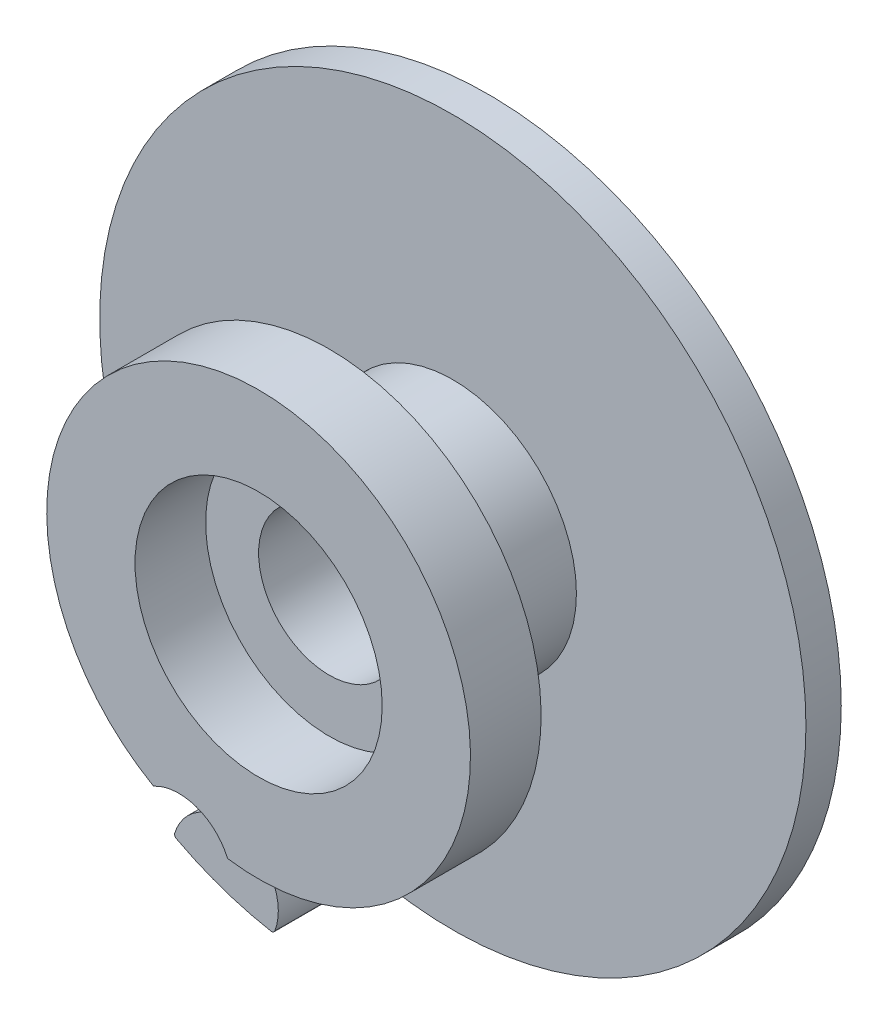
from build123d import *

# Parameters (mm, degrees)
SKETCH1_R           = 2
SKETCH1_R_2         = 0.4
BOSS_EXTRUDE1_DEPTH = 0.2
SKETCH1_9_R         = 0.7
SKETCH1_9_R_2       = 0.4
BOSS_EXTRUDE2_DEPTH = 0.9
BOSS_EXTRUDE3_START = 0.9
SKETCH1_10_R        = 0.7
BOSS_EXTRUDE3_DEPTH = 0.4
BOSS_EXTRUDE4_DEPTH = 0.9


with BuildPart() as part:
    # Sketch1 → Boss-Extrude1 (new body)
    with BuildSketch(Plane.XY):
        with Locations((0, 13.134272207)):
            Circle(SKETCH1_R)
        with Locations((0, 13.134272207)):
            Circle(SKETCH1_R_2, mode=Mode.SUBTRACT)
    extrude(amount=BOSS_EXTRUDE1_DEPTH)

    # Sketch1<9> → Boss-Extrude2 (add)
    with BuildSketch(Plane.XY):
        with Locations((0, 13.134272207)):
            Circle(SKETCH1_9_R)
        with Locations((0, 13.134272207)):
            Circle(SKETCH1_9_R_2, mode=Mode.SUBTRACT)
    extrude(amount=BOSS_EXTRUDE2_DEPTH)

    # Sketch1<11> → Boss-Extrude4 (add)
    with BuildSketch(Plane.XY):
        with BuildLine():
            ThreePointArc((-0.722952446, 11.701281818), (-0.80562228, 11.640057681), (-0.862748393, 11.554504753))
            ThreePointArc((-0.862748393, 11.554504753), (-0.769774263, 11.507174305), (-0.674214176, 11.465309882))
            Line((-0.674214176, 11.465309882), (-0.690125144, 11.647173071))
            ThreePointArc((-0.690125144, 11.647173071), (-0.707969637, 11.673359365), (-0.722952446, 11.701281818))
        make_face()
        with BuildLine():
            Line((-0.695904051, 11.713226287), (-0.690125144, 11.647173071))
            ThreePointArc((-0.690125144, 11.647173071), (-0.61018442, 11.574383117), (-0.509631962, 11.53465781))
            Line((-0.509631962, 11.53465781), (-0.526432402, 11.726687722))
            ThreePointArc((-0.526432402, 11.726687722), (-0.612141723, 11.732212758), (-0.695904051, 11.713226287))
        make_face()
        with BuildLine():
            Line((-0.690125144, 11.647173071), (-0.674214176, 11.465309882))
            ThreePointArc((-0.674214176, 11.465309882), (-0.587019252, 11.432682246), (-0.498253958, 11.404606635))
            Line((-0.498253958, 11.404606635), (-0.509631962, 11.53465781))
            ThreePointArc((-0.509631962, 11.53465781), (-0.61018442, 11.574383117), (-0.690125144, 11.647173071))
        make_face()
        with BuildLine():
            ThreePointArc((-0.498253958, 11.404606635), (-0.398618868, 11.378965112), (-0.297681545, 11.359057939))
            ThreePointArc((-0.297681545, 11.359057939), (-0.289740827, 11.461623242), (-0.316916575, 11.560841058))
            ThreePointArc((-0.316916575, 11.560841058), (-0.411093619, 11.531699297), (-0.509631962, 11.53465781))
            Line((-0.509631962, 11.53465781), (-0.498253958, 11.404606635))
        make_face()
        with BuildLine():
            ThreePointArc((-0.509631962, 11.53465781), (-0.411093619, 11.531699297), (-0.316916575, 11.560841058))
            ThreePointArc((-0.316916575, 11.560841058), (-0.402189954, 11.668379407), (-0.526432402, 11.726687722))
            Line((-0.526432402, 11.726687722), (-0.509631962, 11.53465781))
        make_face()
        with BuildLine():
            ThreePointArc((-0.865004944, 11.498953753), (-0.76847241, 11.451432299), (-0.66934047, 11.409603156))
            Line((-0.66934047, 11.409603156), (-0.674214176, 11.465309882))
            ThreePointArc((-0.674214176, 11.465309882), (-0.769774263, 11.507174305), (-0.862748393, 11.554504753))
            ThreePointArc((-0.862748393, 11.554504753), (-0.869199801, 11.538720697), (-0.874744005, 11.522595597))
            ThreePointArc((-0.874744005, 11.522595597), (-0.874145949, 11.509015077), (-0.865004944, 11.498953753))
        make_face()
        with BuildLine():
            Line((-0.674214176, 11.465309882), (-0.66934047, 11.409603156))
            ThreePointArc((-0.66934047, 11.409603156), (-0.582196295, 11.37826894), (-0.49359328, 11.351334835))
            Line((-0.49359328, 11.351334835), (-0.498253958, 11.404606635))
            ThreePointArc((-0.498253958, 11.404606635), (-0.587019252, 11.432682246), (-0.674214176, 11.465309882))
        make_face()
        with BuildLine():
            ThreePointArc((-0.307964475, 11.326556396), (-0.302360987, 11.342660992), (-0.297681545, 11.359057939))
            ThreePointArc((-0.297681545, 11.359057939), (-0.398618868, 11.378965112), (-0.498253958, 11.404606635))
            Line((-0.498253958, 11.404606635), (-0.49359328, 11.351334835))
            ThreePointArc((-0.49359328, 11.351334835), (-0.412334455, 11.33080879), (-0.330229358, 11.313984161))
            ThreePointArc((-0.330229358, 11.313984161), (-0.316825436, 11.316247586), (-0.307964475, 11.326556396))
        make_face()
        with BuildLine():
            ThreePointArc((-0.695904051, 11.713226287), (-0.709575496, 11.707587495), (-0.722952446, 11.701281818))
            ThreePointArc((-0.722952446, 11.701281818), (-0.707969637, 11.673359365), (-0.690125144, 11.647173071))
            Line((-0.690125144, 11.647173071), (-0.695904051, 11.713226287))
        make_face()
    extrude(amount=BOSS_EXTRUDE4_DEPTH)


with BuildPart() as body_2:
    # Sketch1<10> → Boss-Extrude3 (new body)
    with BuildSketch(Plane.XY.offset(BOSS_EXTRUDE3_START)):
        with BuildLine():
            ThreePointArc((1.2, 13.134272207), (-0.602387358, 14.172120689), (-0.595215785, 12.092294199))
            ThreePointArc((-0.595215785, 12.092294199), (-0.353417508, 12.112487744), (-0.175768873, 11.947214794))
            ThreePointArc((-0.175768873, 11.947214794), (0.783925173, 12.225723186), (1.2, 13.134272207))
        make_face()
        with Locations((0, 13.134272207)):
            Circle(SKETCH1_10_R, mode=Mode.SUBTRACT)
    extrude(amount=BOSS_EXTRUDE3_DEPTH)


solid = Compound([part.part, body_2.part])
